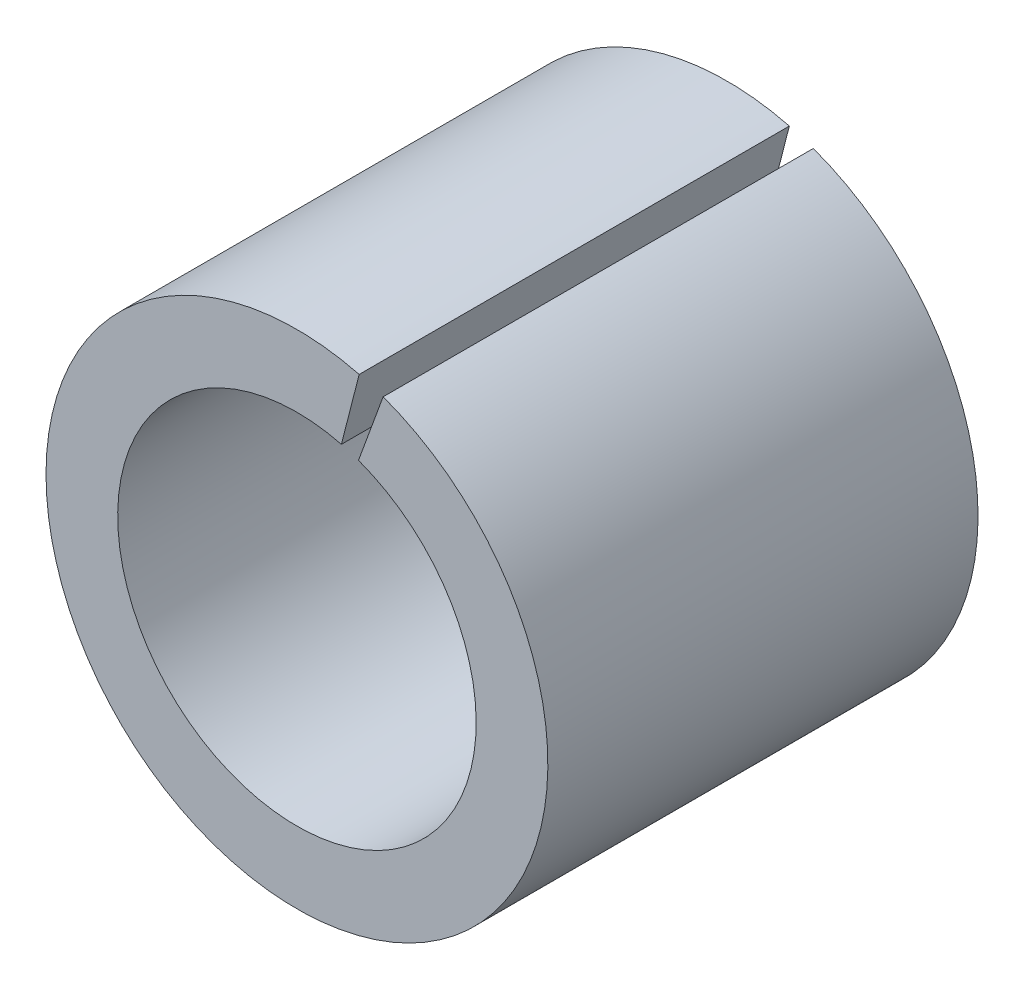
from build123d import *

# Parameters (mm, degrees)
SKETCH_1_R          = 3.5
SKETCH_1_R_2        = 2.5
EXTRUDE_1_DEPTH     = 6
CUT_EXTRUDE_1_DEPTH = 6


with BuildPart() as part:
    # 草图1 → 凸台-拉伸1 (new body)
    with BuildSketch(Plane.XY):
        Circle(SKETCH_1_R)
        Circle(SKETCH_1_R_2, mode=Mode.SUBTRACT)
    extrude(amount=EXTRUDE_1_DEPTH)

    # 草图2 → 切除-拉伸1 (cut)
    with BuildSketch(Plane.XY.offset(6)):
        Polygon((0, 0), (1.195643568, 4.670187004), (1.708170359, 4.670187004), align=None)
    extrude(amount=-CUT_EXTRUDE_1_DEPTH, mode=Mode.SUBTRACT)


solid = part.part
